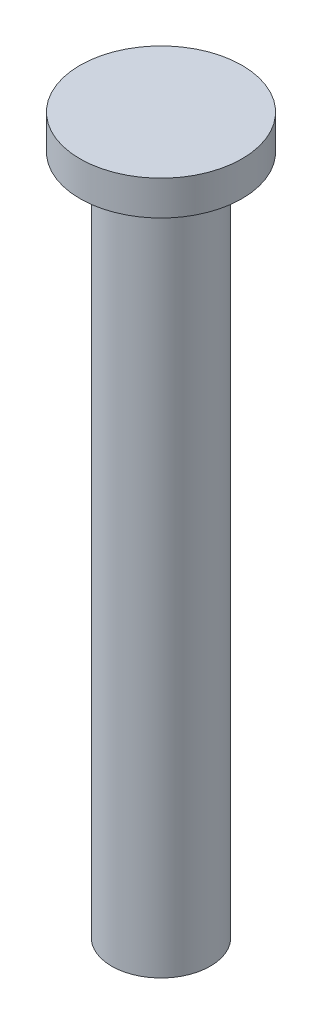
from build123d import *

# Parameters (mm, degrees)
SKETCH1_R           = 10
BOSS_EXTRUDE1_DEPTH = 138
SKETCH2_R           = 16.431374592
BOSS_EXTRUDE2_DEPTH = 7


with BuildPart() as part:
    # Sketch1 → Boss-Extrude1 (new body)
    with BuildSketch(Plane(origin=(0, 0, 0), x_dir=(1, 0, 0), z_dir=(0, 1, 0))):
        with Locations(Location((0, 0, 0), (0, 0, 270))):
            Circle(SKETCH1_R)
    extrude(amount=-BOSS_EXTRUDE1_DEPTH)

    # Sketch2 → Boss-Extrude2 (add)
    with BuildSketch(Plane(origin=(0, 0, 0), x_dir=(1, 0, 0), z_dir=(0, 1, 0))):
        with Locations(Location((0, 0, 0), (0, 0, 90))):
            Circle(SKETCH2_R)
    extrude(amount=BOSS_EXTRUDE2_DEPTH)


solid = part.part
